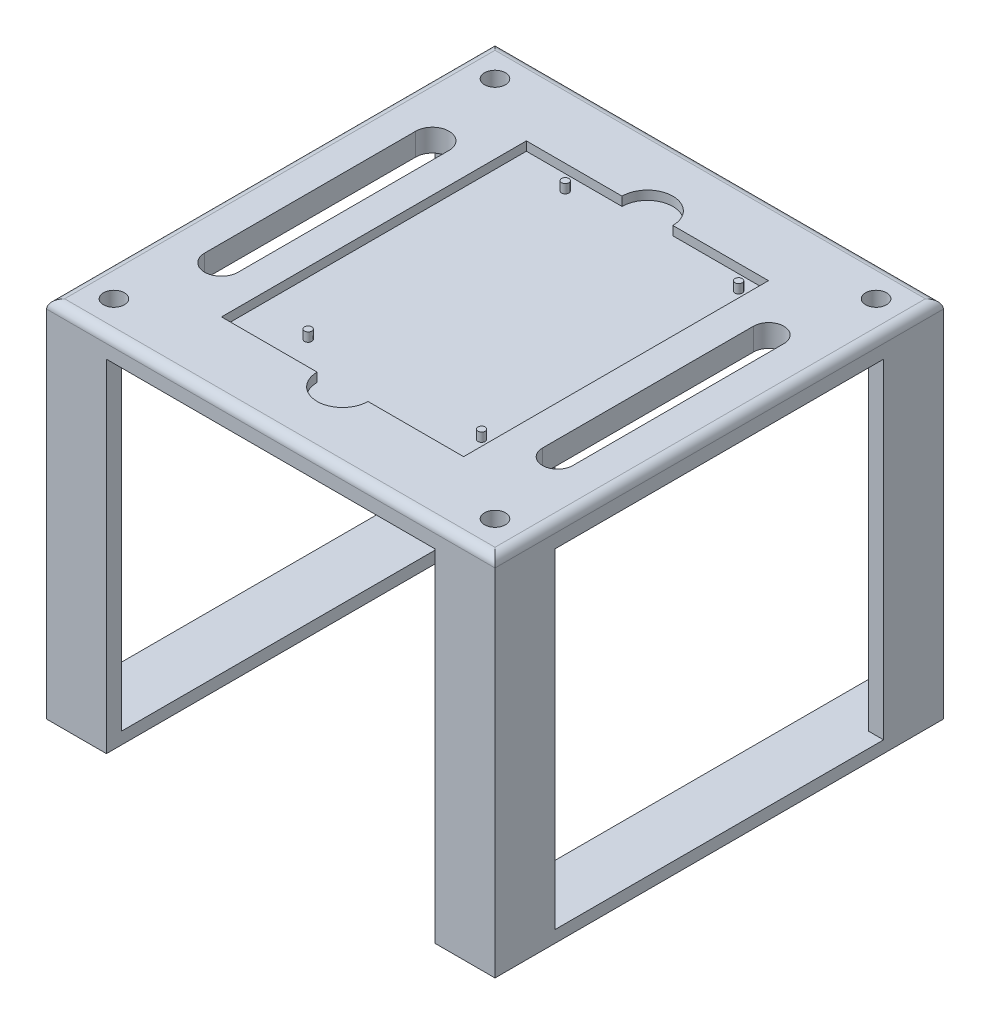
from build123d import *

# Parameters (mm, degrees)
SKETCH1_W           = 150
SKETCH1_H           = 150
BOSS_EXTRUDE1_DEPTH = 7.5
BOSS_EXTRUDE2_DEPTH = 114.3
FILLET1_R           = 3
SKETCH3_W           = 20.043778543
SKETCH3_H           = 150
SKETCH3_W_2         = 20
BOSS_EXTRUDE3_DEPTH = 4
SKETCH5_W           = 81
SKETCH5_H           = 102
CUT_EXTRUDE1_DEPTH  = 3
CUT_EXTRUDE3_REACH  = 163.509
SKETCH7_R           = 1.225
BOSS_EXTRUDE4_DEPTH = 3
SKETCH8_R           = 3.5
CUT_EXTRUDE4_DEPTH  = 7.5
SKETCH9_R           = 5
SKETCH9_R_2         = 3.5
BOSS_EXTRUDE5_DEPTH = 6
SKETCH10_R          = 8.5
CUT_EXTRUDE5_DEPTH  = 3


with BuildPart() as part:
    # Sketch1 → Boss-Extrude1 (new body)
    with BuildSketch(Plane(origin=(0, 0, 0), x_dir=(1, 0, 0), z_dir=(0, 1, 0))):
        Rectangle(SKETCH1_W, SKETCH1_H)
    extrude(amount=BOSS_EXTRUDE1_DEPTH)

    # Sketch2 → Boss-Extrude2 (add)
    with BuildSketch(Plane.XZ):
        Polygon((-75, 75), (-55, 75), (-55, 70), (-70, 70), (-70, 55), (-75, 55), align=None)
        Polygon((75, 75), (54.956221457, 75), (54.956221457, 70), (69.950175757, 70), (69.950175757, 55), (75, 55), align=None)
        Polygon((-75, -75), (-55, -75), (-55, -69.976562657), (-70, -69.976562657), (-70, -55.000720359), (-75, -55.000720359), align=None)
        Polygon((75, -75), (54.956221457, -75), (54.956221457, -69.976562657), (69.950175757, -69.976562657), (69.950175757, -55.000720359), (75, -55.000720359), align=None)
    extrude(amount=BOSS_EXTRUDE2_DEPTH)

    # Fillet1
    fillet1_edges = [part.edges().sort_by_distance(p)[0] for p in [
        (-75, 7.5, 0),
        (0, 7.5, 75),
        (75, 7.5, 0),
        (0, 7.5, -75),
    ]]
    fillet(fillet1_edges, radius=FILLET1_R)

    # Sketch3 → Boss-Extrude3 (add)
    with BuildSketch(Plane.XZ.offset(114.3)):
        with Locations((64.978110728, 0)):
            Rectangle(SKETCH3_W, SKETCH3_H)
        with Locations((-65, 0)):
            Rectangle(SKETCH3_W_2, SKETCH3_H)
    extrude(amount=-BOSS_EXTRUDE3_DEPTH)

    # Sketch5 → Cut-Extrude1 (cut)
    with BuildSketch(Plane(origin=(0, 7.5, 0), x_dir=(1, 0, 0), z_dir=(0, 1, 0))):
        Rectangle(SKETCH5_W, SKETCH5_H)
    extrude(amount=-CUT_EXTRUDE1_DEPTH, mode=Mode.SUBTRACT)

    # Sketch6 → Cut-Extrude3 (cut, up to next)
    with BuildSketch(Plane(origin=(0, 7.5, 0), x_dir=(1, 0, 0), z_dir=(0, 1, 0)), mode=Mode.PRIVATE) as cut_extrude3_sk1:
        with BuildLine():
            Line((-50.674102898, 35.299678475), (-50.674102898, -35.299678475))
            ThreePointArc((-50.674102898, -35.299678475), (-56.25, -40.875575577), (-61.825897102, -35.299678475))
            Line((-61.825897102, -35.299678475), (-61.825897102, 35.299678475))
            ThreePointArc((-61.825897102, 35.299678475), (-56.25, 40.875575577), (-50.674102898, 35.299678475))
        make_face()
    cut_extrude3_tool1 = extrude(cut_extrude3_sk1.sketch, amount=-CUT_EXTRUDE3_REACH, mode=Mode.PRIVATE) & part.part
    # Sketch6 → Cut-Extrude3 (cut, up to next)
    with BuildSketch(Plane(origin=(0, 7.5, 0), x_dir=(1, 0, 0), z_dir=(0, 1, 0)), mode=Mode.PRIVATE) as cut_extrude3_sk2:
        with BuildLine():
            Line((61.3258971, 35.299678475), (61.3258971, -35.299678475))
            ThreePointArc((61.3258971, -35.299678475), (56.25, -40.375575575), (51.1741029, -35.299678475))
            Line((51.1741029, -35.299678475), (51.1741029, 35.299678475))
            ThreePointArc((51.1741029, 35.299678475), (56.25, 40.375575575), (61.3258971, 35.299678475))
        make_face()
    cut_extrude3_tool2 = extrude(cut_extrude3_sk2.sketch, amount=-CUT_EXTRUDE3_REACH, mode=Mode.PRIVATE) & part.part
    add(cut_extrude3_tool1.solids().sort_by_distance((-56.25, 7.5, 0))[0], mode=Mode.SUBTRACT)
    add(cut_extrude3_tool2.solids().sort_by_distance((56.25, 7.5, 0))[0], mode=Mode.SUBTRACT)

    # Sketch7 → Boss-Extrude4 (add)
    with BuildSketch(Plane(origin=(0, 4.5, 0), x_dir=(1, 0, 0), z_dir=(0, 1, 0))):
        with Locations(Location((35.5, 46, 0), (0, 0, 270))):
            Circle(SKETCH7_R)
        with Locations(Location((-22.5, 46, 0), (0, 0, 270))):
            Circle(SKETCH7_R)
        with Locations(Location((-22.5, -40, 0), (0, 0, 270))):
            Circle(SKETCH7_R)
        with Locations(Location((35.5, -40, 0), (0, 0, 270))):
            Circle(SKETCH7_R)
    extrude(amount=BOSS_EXTRUDE4_DEPTH)

    # Sketch8 → Cut-Extrude4 (cut)
    with BuildSketch(Plane(origin=(0, 7.5, 0), x_dir=(1, 0, 0), z_dir=(0, 1, 0))):
        with Locations(Location((-63.75, -63.75, 0), (0, 0, 270))):
            Circle(SKETCH8_R)
        with Locations(Location((63.75, -63.75, 0), (0, 0, 270))):
            Circle(SKETCH8_R)
        with Locations(Location((-63.75, 63.75, 0), (0, 0, 270))):
            Circle(SKETCH8_R)
        with Locations(Location((63.75, 63.75, 0), (0, 0, 270))):
            Circle(SKETCH8_R)
    extrude(amount=-CUT_EXTRUDE4_DEPTH, mode=Mode.SUBTRACT)

    # Sketch9 → Boss-Extrude5 (add)
    # profile 1 of 4: a face of its own
    with BuildSketch(Plane.XZ):
        with Locations(Location((-63.75, 63.75, 0), (0, 0, 90))):
            Circle(SKETCH9_R)
        with Locations(Location((-63.75, 63.75, 0), (0, 0, 90))):
            Circle(SKETCH9_R_2, mode=Mode.SUBTRACT)
    # profile 2 of 4: a face of its own
    with BuildSketch(Plane.XZ):
        with Locations(Location((63.75, 63.75, 0), (0, 0, 90))):
            Circle(SKETCH9_R)
        with Locations(Location((63.75, 63.75, 0), (0, 0, 90))):
            Circle(SKETCH9_R_2, mode=Mode.SUBTRACT)
    # profile 3 of 4: a face of its own
    with BuildSketch(Plane.XZ):
        with Locations(Location((63.75, -63.75, 0), (0, 0, 90))):
            Circle(SKETCH9_R)
        with Locations(Location((63.75, -63.75, 0), (0, 0, 90))):
            Circle(SKETCH9_R_2, mode=Mode.SUBTRACT)
    # profile 4 of 4: a face of its own
    with BuildSketch(Plane.XZ):
        with Locations(Location((-63.75, -63.75, 0), (0, 0, 90))):
            Circle(SKETCH9_R)
        with Locations(Location((-63.75, -63.75, 0), (0, 0, 90))):
            Circle(SKETCH9_R_2, mode=Mode.SUBTRACT)
    extrude(amount=BOSS_EXTRUDE5_DEPTH)

    # Sketch10 → Cut-Extrude5 (cut)
    with BuildSketch(Plane(origin=(0, 7.5, 0), x_dir=(1, 0, 0), z_dir=(0, 1, 0))):
        with Locations((0, 51)):
            Circle(SKETCH10_R)
        with Locations((0, -51)):
            Circle(SKETCH10_R)
    extrude(amount=-CUT_EXTRUDE5_DEPTH, mode=Mode.SUBTRACT)


solid = part.part
